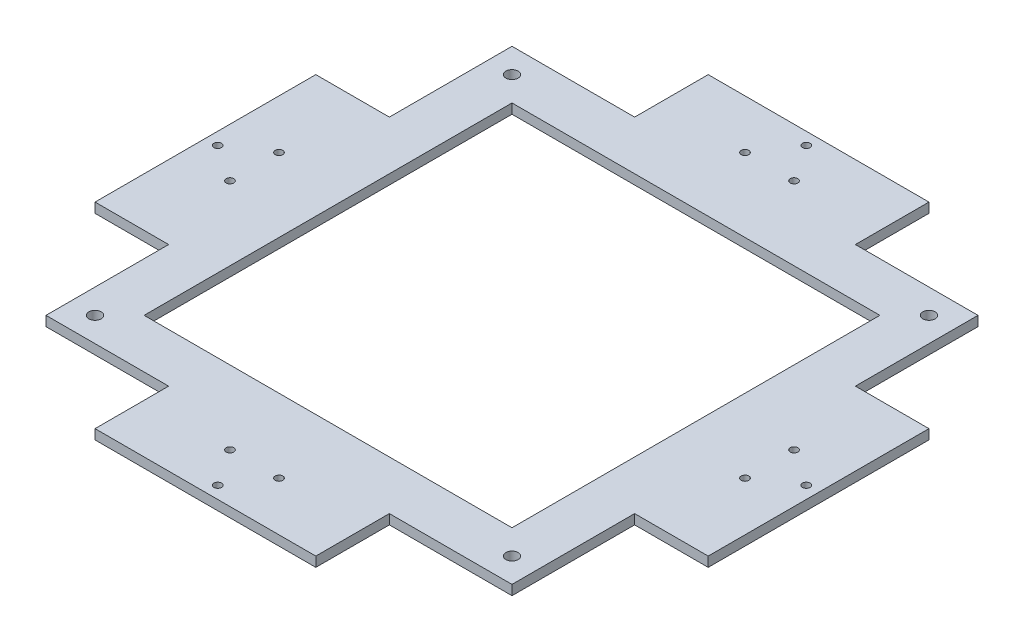
from build123d import *

# Parameters (mm, degrees)
CROQUIS1_W              = 250
CROQUIS1_H              = 250
CROQUIS1_R              = 2.5
SALIENTE_EXTRUIR1_DEPTH = 4
CORTAR_EXTRUIR1_DEPTH   = 4
CROQUIS3_W              = 150
CROQUIS3_H              = 150
CROQUIS3_W_2            = 100
CROQUIS3_H_2            = 100
SALIENTE_EXTRUIR2_DEPTH = 4
CROQUIS4_R              = 1.55
CORTAR_EXTRUIR2_DEPTH   = 10
CROQUIS5_W              = 150
CROQUIS5_H              = 150
CROQUIS5_W_2            = 100
CROQUIS5_H_2            = 100
CORTAR_EXTRUIR3_DEPTH   = 10
CROQUIS6_W              = 30
CROQUIS6_H              = 50
CROQUIS6_W_2            = 50
CROQUIS6_H_2            = 30
CORTAR_EXTRUIR4_DEPTH   = 10
CROQUIS8_R              = 1.55
CORTAR_EXTRUIR5_DEPTH   = 10


with BuildPart() as part:
    # Croquis1 → Saliente-Extruir1 (new body)
    with BuildSketch(Plane(origin=(0, 0, 0), x_dir=(1, 0, 0), z_dir=(0, 1, 0))):
        with Locations((125, 125)):
            Rectangle(CROQUIS1_W, CROQUIS1_H)
        with Locations(Location((40, 210, 0), (0, 0, 270))):
            Circle(CROQUIS1_R, mode=Mode.SUBTRACT)
        with Locations(Location((210, 210, 0), (0, 0, 270))):
            Circle(CROQUIS1_R, mode=Mode.SUBTRACT)
        with Locations(Location((210, 40, 0), (0, 0, 270))):
            Circle(CROQUIS1_R, mode=Mode.SUBTRACT)
        with Locations(Location((40, 40, 0), (0, 0, 270))):
            Circle(CROQUIS1_R, mode=Mode.SUBTRACT)
    extrude(amount=SALIENTE_EXTRUIR1_DEPTH)

    # Croquis2 → Cortar-Extruir1 (cut)
    with BuildSketch(Plane(origin=(0, 4, 0), x_dir=(1, 0, 0), z_dir=(0, 1, 0))):
        Polygon((50, 50), (200, 50), (200, 200), (50, 200), (50, 150.09044268), align=None)
    extrude(amount=-CORTAR_EXTRUIR1_DEPTH, mode=Mode.SUBTRACT)

    # Croquis3 → Saliente-Extruir2 (add)
    with BuildSketch(Plane(origin=(0, 4, 0), x_dir=(1, 0, 0), z_dir=(0, 1, 0))):
        with Locations((125, 125)):
            Rectangle(CROQUIS3_W, CROQUIS3_H)
        with Locations((125, 125)):
            Rectangle(CROQUIS3_W_2, CROQUIS3_H_2, mode=Mode.SUBTRACT)
    extrude(amount=-SALIENTE_EXTRUIR2_DEPTH)

    # Croquis4 → Cortar-Extruir2 (cut)
    with BuildSketch(Plane(origin=(0, 4, 0), x_dir=(1, 0, 0), z_dir=(0, 1, 0))):
        with Locations(Location((115, 20, 0), (0, 0, 270))):
            Circle(CROQUIS4_R)
        with Locations(Location((135, 20, 0), (0, 0, 270))):
            Circle(CROQUIS4_R)
        with Locations(Location((125, 5, 0), (0, 0, 270))):
            Circle(CROQUIS4_R)
    extrude(amount=-CORTAR_EXTRUIR2_DEPTH, mode=Mode.SUBTRACT)

    # Croquis5 → Cortar-Extruir3 (cut)
    with BuildSketch(Plane(origin=(0, 4, 0), x_dir=(1, 0, 0), z_dir=(0, 1, 0))):
        with Locations((125, 125)):
            Rectangle(CROQUIS5_W, CROQUIS5_H)
        with Locations((125, 125)):
            Rectangle(CROQUIS5_W_2, CROQUIS5_H_2, mode=Mode.SUBTRACT)
    extrude(amount=-CORTAR_EXTRUIR3_DEPTH, mode=Mode.SUBTRACT)

    # Croquis6 → Cortar-Extruir4 (cut)
    with BuildSketch(Plane(origin=(0, 4, 0), x_dir=(1, 0, 0), z_dir=(0, 1, 0))):
        Polygon((170, 0), (250, 0), (250, 30), (220, 30), (170, 30), align=None)
        with Locations((235, 55)):
            Rectangle(CROQUIS6_W, CROQUIS6_H)
        Polygon((0, 80), (0, 0), (30, 0), (30, 30), (30, 80), align=None)
        with Locations((55, 15)):
            Rectangle(CROQUIS6_W_2, CROQUIS6_H_2)
        Polygon((80, 250), (0, 250), (0, 220), (30, 220), (80, 220), align=None)
        with Locations((15, 195)):
            Rectangle(CROQUIS6_W, CROQUIS6_H)
        Polygon((250, 170), (250, 250), (220, 250), (220, 220), (220, 170), align=None)
        with Locations((195, 235)):
            Rectangle(CROQUIS6_W_2, CROQUIS6_H_2)
    extrude(amount=-CORTAR_EXTRUIR4_DEPTH, mode=Mode.SUBTRACT)

    # Croquis8 → Cortar-Extruir5 (cut)
    with BuildSketch(Plane(origin=(0, 4, 0), x_dir=(1, 0, 0), z_dir=(0, 1, 0))):
        with Locations(Location((125, 5, 0), (0, 0, 270))):
            Circle(CROQUIS8_R)
        with Locations(Location((135, 20, 0), (0, 0, 270))):
            Circle(CROQUIS8_R)
        with Locations(Location((115, 20, 0), (0, 0, 270))):
            Circle(CROQUIS8_R)
        with Locations(Location((20, 135, 0), (0, 0, 270))):
            Circle(CROQUIS8_R)
        with Locations(Location((5, 125, 0), (0, 0, 270))):
            Circle(CROQUIS8_R)
        with Locations(Location((20, 115, 0), (0, 0, 270))):
            Circle(CROQUIS8_R)
        with Locations(Location((135, 230, 0), (0, 0, 270))):
            Circle(CROQUIS8_R)
        with Locations(Location((125, 245, 0), (0, 0, 270))):
            Circle(CROQUIS8_R)
        with Locations(Location((115, 230, 0), (0, 0, 270))):
            Circle(CROQUIS8_R)
        with Locations(Location((230, 115, 0), (0, 0, 270))):
            Circle(CROQUIS8_R)
        with Locations(Location((245, 125, 0), (0, 0, 270))):
            Circle(CROQUIS8_R)
        with Locations(Location((230, 135, 0), (0, 0, 270))):
            Circle(CROQUIS8_R)
    extrude(amount=-CORTAR_EXTRUIR5_DEPTH, mode=Mode.SUBTRACT)


solid = part.part
